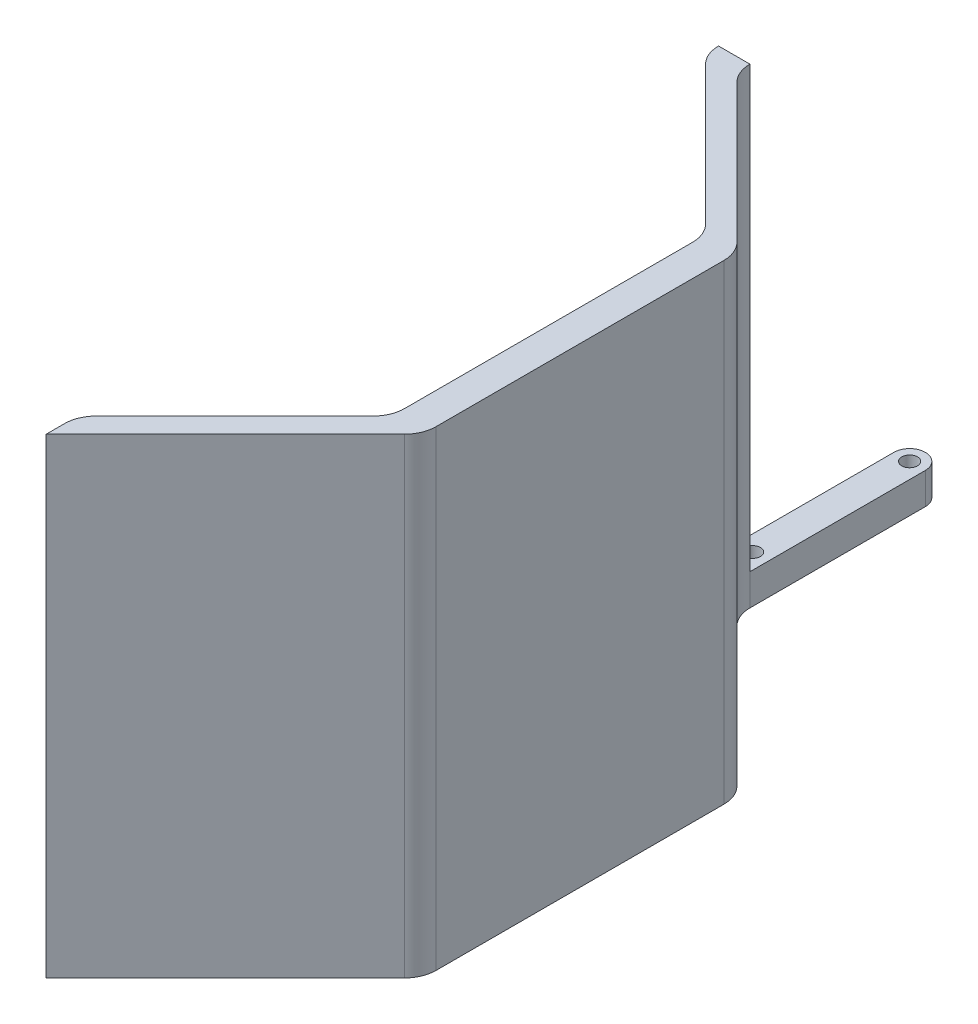
from build123d import *

# Parameters (mm, degrees)
EXTRUDE_1_DEPTH     = 150
CUT_EXTRUDE_START   = -140
CUT_EXTRUDE_1_DEPTH = 140
SKETCH_5_R          = 2.5
CUT_EXTRUDE_2_DEPTH = 302.021089881


with BuildPart() as part:
    # 草图1 → 凸台-拉伸1 (new body)
    with BuildSketch(Plane(origin=(0, 0, 0), x_dir=(1, 0, 0), z_dir=(0, 1, 0))):
        with BuildLine():
            Line((83.929371052, -4.001384199), (83.929371052, 45.998615801))
            ThreePointArc((83.929371052, 45.998615801), (78.929371052, 50.998615801), (73.929371052, 45.998615801))
            Line((73.929371052, 45.998615801), (73.929371052, -4.001384199))
            Line((73.929371052, -4.001384199), (73.929371052, -9.859248575))
            ThreePointArc((73.929371052, -9.859248575), (74.690575727, -13.686082899), (76.85830324, -16.930316387))
            Line((76.85830324, -16.930316387), (121.000438864, -61.072452011))
            ThreePointArc((121.000438864, -61.072452011), (123.168166377, -64.316685499), (123.929371052, -68.143519823))
            Line((123.929371052, -68.143519823), (123.929371052, -159.859248575))
            ThreePointArc((123.929371052, -159.859248575), (123.168166377, -163.686082899), (121.000438864, -166.930316387))
            Line((121.000438864, -166.930316387), (76.85830324, -211.072452011))
            ThreePointArc((76.85830324, -211.072452011), (74.690575727, -214.316685499), (73.929371052, -218.143519823))
            Line((73.929371052, -218.143519823), (73.929371052, -224.001384199))
            Line((73.929371052, -224.001384199), (131.000438864, -166.930316387))
            ThreePointArc((131.000438864, -166.930316387), (133.168166377, -163.686082899), (133.929371052, -159.859248575))
            Line((133.929371052, -159.859248575), (133.929371052, -68.143519823))
            ThreePointArc((133.929371052, -68.143519823), (133.168166377, -64.316685499), (131.000438864, -61.072452011))
            Line((131.000438864, -61.072452011), (86.85830324, -16.930316387))
            ThreePointArc((86.85830324, -16.930316387), (84.690575727, -13.686082899), (83.929371052, -9.859248575))
            Line((83.929371052, -9.859248575), (83.929371052, -4.001384199))
        make_face()
    extrude(amount=EXTRUDE_1_DEPTH)

    # 草图3 → 切除-拉伸1 (cut)
    with BuildSketch(Plane(origin=(0, 150, 0), x_dir=(1, 0, 0), z_dir=(0, 1, 0)).offset(CUT_EXTRUDE_START)):
        with BuildLine():
            Line((83.929371052, -9.859248575), (73.929371052, -9.859248575))
            Line((73.929371052, -9.859248575), (73.929371052, 45.998615801))
            ThreePointArc((73.929371052, 45.998615801), (78.929371052, 50.998615801), (83.929371052, 45.998615801))
            Line((83.929371052, 45.998615801), (83.929371052, -9.859248575))
        make_face()
    extrude(amount=CUT_EXTRUDE_1_DEPTH, mode=Mode.SUBTRACT)

    # 草图5 → 切除-拉伸2 (cut, through all)
    with BuildSketch(Plane.XZ):
        with Locations(Location((78.929371052, -45.998615801, 0), (0, 0, 270))):
            Circle(SKETCH_5_R)
        with Locations(Location((78.929371052, 4.001384199, 0), (0, 0, 270))):
            Circle(SKETCH_5_R)
    extrude(amount=-CUT_EXTRUDE_2_DEPTH, mode=Mode.SUBTRACT)


solid = part.part
